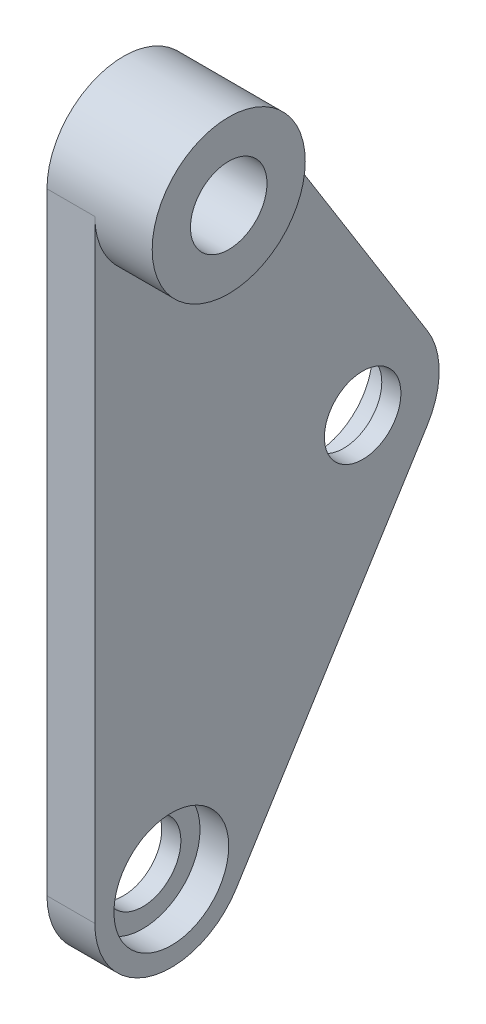
from build123d import *
from build123d.topology import SkipClean

# Parameters (mm, degrees)
EXTRUDE_1_DEPTH          = 2.5
EXTRUDE_START            = -3
SKETCH_1_4_R             = 4
EXTRUDE_2_DEPTH          = 3
CUT_EXTRUDE_1_DEPTH      = 44.965895874
CUT_EXTRUDE_1_DEPTH_BACK = 44.965895874
SKETCH_1_3_R             = 2
SKETCH_2_R               = 3
CUT_EXTRUDE_2_DEPTH      = 1.5
CUT_EXTRUDE_START        = -2.5
SKETCH_2_3_R             = 3
CUT_EXTRUDE_3_DEPTH      = 1.5
SKETCH_3_W               = 21.826299482
SKETCH_3_H               = 56.481797896
CUT_EXTRUDE_4_DEPTH      = 50.297565863


with BuildPart() as part:
    # 草图1 → 凸台-拉伸1 (new body)
    with BuildSketch(Plane(origin=(0, 0, 0), x_dir=(0, 0, -1), z_dir=(1, 0, 0))):
        with BuildLine():
            Line((17.391993216, -17.88000424), (7.391993216, -1.88000424))
            ThreePointArc((7.391993216, -1.88000424), (2.897269948, -0.155005015), (0, -4))
            Line((0, -4), (0, -36))
            ThreePointArc((0, -36), (2.897269948, -39.844994985), (7.391993216, -38.11999576))
            Line((7.391993216, -38.11999576), (17.391993216, -22.11999576))
            ThreePointArc((17.391993216, -22.11999576), (18, -20), (17.391993216, -17.88000424))
        make_face()
    extrude(amount=EXTRUDE_1_DEPTH)

    # 草图1<4> → 凸台-拉伸2 (add)
    with SkipClean():  # the faces are left unmerged after this step: merging them gives an invalid solid
        with BuildSketch(Plane(origin=(0, 0, 0), x_dir=(0, 0, -1), z_dir=(1, 0, 0)).offset(EXTRUDE_START)):
            with Locations(Location((4, -4, 0), (0, 0, 180))):
                Circle(SKETCH_1_4_R)
        extrude(amount=EXTRUDE_2_DEPTH)

    # 草图1<3> → 切除-拉伸1 (cut, two sides: drawn at the far end of the back side and taken through both)
    with SkipClean():  # the faces are left unmerged after this step: merging them gives an invalid solid
        with BuildSketch(Plane(origin=(0, 0, 0), x_dir=(0, 0, -1), z_dir=(1, 0, 0)).offset(-CUT_EXTRUDE_1_DEPTH_BACK)):
            with Locations((4, -4)):
                Circle(SKETCH_1_3_R)
            with Locations((14, -20)):
                Circle(SKETCH_1_3_R)
            with Locations((4, -36)):
                Circle(SKETCH_1_3_R)
        extrude(amount=CUT_EXTRUDE_1_DEPTH + CUT_EXTRUDE_1_DEPTH_BACK, mode=Mode.SUBTRACT)

    # 草图2 → 切除-拉伸2 (cut)
    with SkipClean():  # the faces are left unmerged after this step: merging them gives an invalid solid
        with BuildSketch(Plane(origin=(2.5, 0, 0), x_dir=(0, 0, -1), z_dir=(1, 0, 0))):
            with Locations((4, -4)):
                Circle(SKETCH_2_R)
            with Locations((14, -20)):
                Circle(SKETCH_2_R)
        extrude(amount=-CUT_EXTRUDE_2_DEPTH, mode=Mode.SUBTRACT)

    # 草图2<3> → 切除-拉伸3 (cut)
    with SkipClean():  # the faces are left unmerged after this step: merging them gives an invalid solid
        with BuildSketch(Plane(origin=(2.5, 0, 0), x_dir=(0, 0, -1), z_dir=(1, 0, 0)).offset(CUT_EXTRUDE_START)):
            with Locations((4, -36)):
                Circle(SKETCH_2_3_R)
        extrude(amount=CUT_EXTRUDE_3_DEPTH, mode=Mode.SUBTRACT)


with BuildPart() as body_2:
    # 镜向2: mirrored copy
    add(part.part.mirror(Plane(origin=(-10, 0, 0), x_dir=(0, 0, 1), z_dir=(1, 0, 0))))


with BuildPart() as part_1:
    add(part.part)

    # 草图3 → 切除-拉伸4 (cut, through all)
    with BuildSketch(Plane.XY):
        with Locations((1.838530602, -21.590992799)):
            Rectangle(SKETCH_3_W, SKETCH_3_H)
    extrude(amount=-CUT_EXTRUDE_4_DEPTH, mode=Mode.SUBTRACT)


solid = body_2.part
